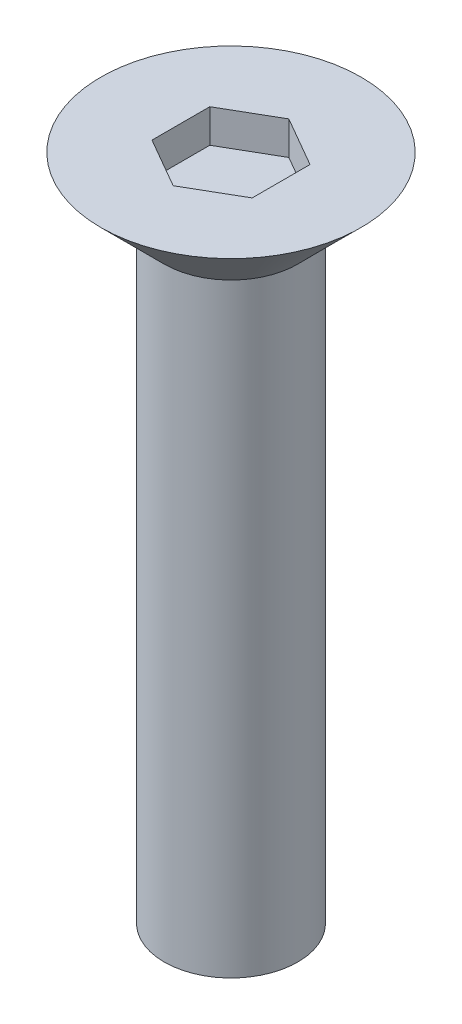
from build123d import *

# Parameters (mm, degrees)
SKETCH1_R           = 2
BOSS_EXTRUDE1_DEPTH = 20
CUT_EXTRUDE1_DEPTH  = 1


with BuildPart() as part:
    # Sketch1 → Boss-Extrude1 (new body)
    with BuildSketch(Plane(origin=(0, 0, 0), x_dir=(1, 0, 0), z_dir=(0, 1, 0))):
        with Locations(Location((0, 0, 0), (0, 0, 270))):
            Circle(SKETCH1_R)
    extrude(amount=BOSS_EXTRUDE1_DEPTH)

    # Sketch3 → Revolve1 (revolve)
    with BuildSketch(Plane(origin=(0, 0, 0), x_dir=(0, 0, -1), z_dir=(1, 0, 0)), mode=Mode.PRIVATE) as revolve1_sk:
        Polygon((0, 20), (3.9, 20), (0, 16.1), align=None)
    revolve(revolve1_sk.sketch.rotate(Axis((0, 16.1, 0), (0, 1, 0)), 180), axis=Axis((0, 16.1, 0), (0, 1, 0)))

    # Sketch4 → Cut-Extrude1 (cut)
    with BuildSketch(Plane(origin=(0, 20, 0), x_dir=(1, 0, 0), z_dir=(0, 1, 0))):
        Polygon((0, 1.732050808), (-1.5, 0.866025404), (-1.5, -0.866025404), (0, -1.732050808), (1.5, -0.866025404), (1.5, 0.866025404), align=None)
    extrude(amount=-CUT_EXTRUDE1_DEPTH, mode=Mode.SUBTRACT)


solid = part.part
